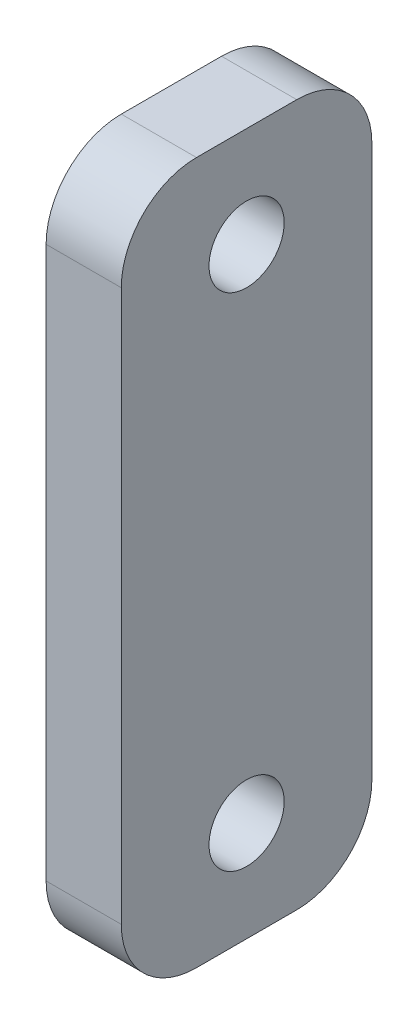
from build123d import *

# Parameters (mm, degrees)
SKETCH1_W           = 50
SKETCH1_H           = 140
BOSS_EXTRUDE1_DEPTH = 15
SKETCH1_3_R         = 7.5
CUT_EXTRUDE1_DEPTH  = 76.828754441
FILLET1_R           = 15


with BuildPart() as part:
    # Sketch1 → Boss-Extrude1 (new body)
    with BuildSketch(Plane(origin=(0, 0, 0), x_dir=(0, 0, -1), z_dir=(1, 0, 0))):
        Rectangle(SKETCH1_W, SKETCH1_H)
    extrude(amount=BOSS_EXTRUDE1_DEPTH)

    # Sketch1<3> → Cut-Extrude1 (cut, through all)
    with BuildSketch(Plane(origin=(0, 0, 0), x_dir=(0, 0, -1), z_dir=(1, 0, 0))):
        with Locations((0, 50)):
            Circle(SKETCH1_3_R)
        with Locations((0, -50)):
            Circle(SKETCH1_3_R)
    extrude(amount=CUT_EXTRUDE1_DEPTH, mode=Mode.SUBTRACT)

    # Fillet1
    fillet1_edges = [part.edges().sort_by_distance(p)[0] for p in [
        (7.5, -70, -25),
        (7.5, -70, 25),
        (7.5, 70, -25),
        (7.5, 70, 25),
    ]]
    fillet(fillet1_edges, radius=FILLET1_R)


solid = part.part
